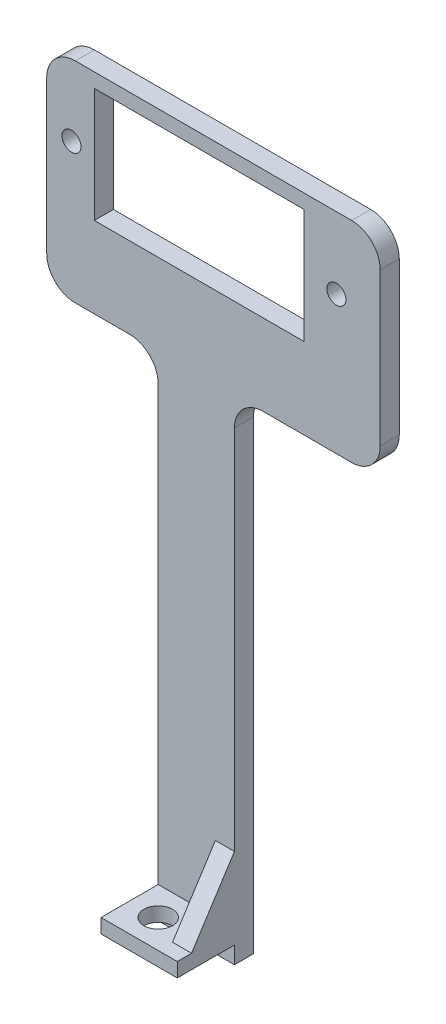
from build123d import *

# Parameters (mm, degrees)
SKETCH_6_W          = 8
SKETCH_6_H          = 6
SKETCH_6_R          = 1.5
EXTRUDE_1_DEPTH     = 1.5
SKETCH_7_W          = 8
SKETCH_7_H          = 25
EXTRUDE_2_DEPTH     = 2
SKETCH_8_W          = 35
SKETCH_8_H          = 2
EXTRUDE_3_DEPTH     = 22
SKETCH_9_W          = 22
SKETCH_9_H          = 12
CUT_EXTRUDE_1_DEPTH = 10
SKETCH_14_W         = 8
SKETCH_14_H         = 6
CUT_EXTRUDE_2_DEPTH = 4.6
RIB_3_REACH         = 76.814
SKETCH_15_WALL_W    = 159.949062396
SKETCH_15_WALL_H    = 2
FILLET_2_R          = 3
SKETCH_16_W         = 8
SKETCH_16_H         = 2
EXTRUDE_4_DEPTH     = 1.8
SKETCH_17_R         = 1
CUT_EXTRUDE_3_DEPTH = 10


with BuildPart() as part:
    # 草图6 → 凸台-拉伸1 (new body)
    with BuildSketch(Plane(origin=(0, 0, 0), x_dir=(1, 0, 0), z_dir=(0, 1, 0))):
        with Locations((1, 0)):
            Rectangle(SKETCH_6_W, SKETCH_6_H)
        with Locations(Location((0, 0, 0), (0, 0, 270))):
            Circle(SKETCH_6_R, mode=Mode.SUBTRACT)
    extrude(amount=EXTRUDE_1_DEPTH)

    # 草图7 → 凸台-拉伸2 (add)
    with BuildSketch(Plane(origin=(0, 0, -3), x_dir=(-1, 0, 0), z_dir=(0, 0, -1))):
        with Locations((-1, 12.5)):
            Rectangle(SKETCH_7_W, SKETCH_7_H)
    extrude(amount=EXTRUDE_2_DEPTH)

    # 镜向1: part across plane


with BuildPart() as part_1:
    add(part.part)
    add(part.part.mirror(Plane(origin=(-3, 25, -5), x_dir=(0, 0, 1), z_dir=(0, -1, 0))))

    # 草图8 → 凸台-拉伸3 (add)
    with BuildSketch(Plane(origin=(0, 50, 0), x_dir=(1, 0, 0), z_dir=(0, 1, 0))):
        with Locations((2.8, 4)):
            Rectangle(SKETCH_8_W, SKETCH_8_H)
    extrude(amount=EXTRUDE_3_DEPTH)

    # 草图9 → 切除-拉伸1 (cut)
    with BuildSketch(Plane(origin=(0, 0, -5), x_dir=(-1, 0, 0), z_dir=(0, 0, -1))):
        with Locations((-1.3, 64.5)):
            Rectangle(SKETCH_9_W, SKETCH_9_H)
    extrude(amount=-CUT_EXTRUDE_1_DEPTH, mode=Mode.SUBTRACT)

    # 草图14 → 切除-拉伸2 (cut)
    with BuildSketch(Plane(origin=(0, 50, 0), x_dir=(1, 0, 0), z_dir=(0, 1, 0))):
        with Locations((1, 0)):
            Rectangle(SKETCH_14_W, SKETCH_14_H)
    extrude(amount=-CUT_EXTRUDE_2_DEPTH, mode=Mode.SUBTRACT)

    # 草图15 wall → 筋3 (add, up to next)
    with BuildSketch(Plane(origin=(5, 5, -0.75), x_dir=(0, 0.841178475377, -0.540757591313), z_dir=(0, 0.540757591313, 0.841178475377)), mode=Mode.PRIVATE) as rib_3_sk1:
        with Locations((0, 1)):
            Rectangle(SKETCH_15_WALL_W, SKETCH_15_WALL_H)
    rib_3_tool1 = extrude(rib_3_sk1.sketch, amount=-RIB_3_REACH, mode=Mode.PRIVATE) - part_1.part
    add(rib_3_tool1.solids().sort_by_distance((5, 5, -0.75))[0])

    # 圆角2
    fillet_2_edges = [part_1.edges().sort_by_distance(p)[0] for p in [
        (-3, 50, -4),
        (5, 50, -4),
        (-14.7, 50, -4),
        (20.3, 50, -4),
        (-14.7, 72, -4),
        (20.3, 72, -4),
    ]]
    fillet(fillet_2_edges, radius=FILLET_2_R)

    # 草图16 → 凸台-拉伸4 (add)
    with BuildSketch(Plane(origin=(0, 0, 0), x_dir=(-1, 0, 0), z_dir=(0, -1, 0))):
        with Locations((-1, 4)):
            Rectangle(SKETCH_16_W, SKETCH_16_H)
    extrude(amount=EXTRUDE_4_DEPTH)

    # 草图17 → 切除-拉伸3 (cut)
    with BuildSketch(Plane(origin=(0, 0, -5), x_dir=(-1, 0, 0), z_dir=(0, 0, -1))):
        with Locations((-15.7, 64.5)):
            Circle(SKETCH_17_R)
        with Locations((12.1, 64.5)):
            Circle(SKETCH_17_R)
    extrude(amount=-CUT_EXTRUDE_3_DEPTH, mode=Mode.SUBTRACT)


solid = part_1.part
